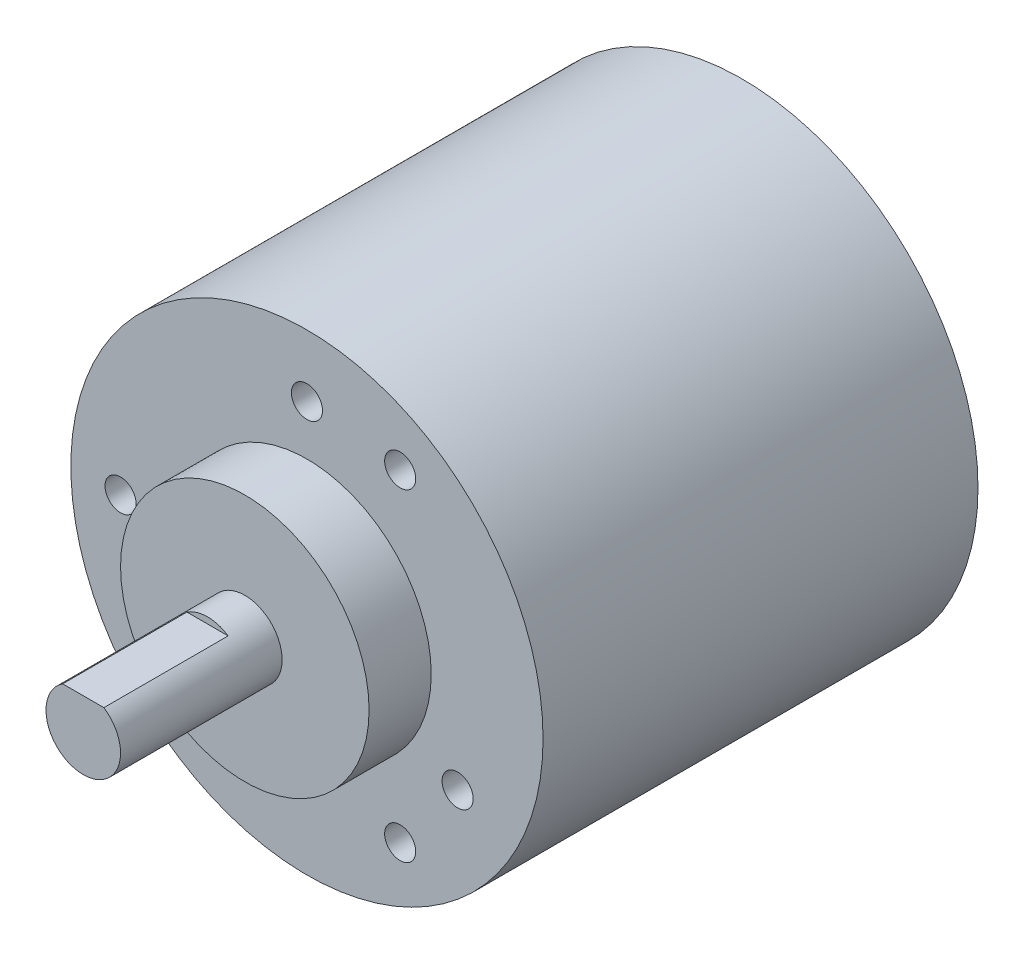
from build123d import *

# Parameters (mm, degrees)
SKETCH1_R                       = 19
BOSS_EXTRUDE1_DEPTH             = 35
SKETCH2_R                       = 10
BOSS_EXTRUDE2_DEPTH             = 5
SKETCH3_R                       = 3
BOSS_EXTRUDE3_DEPTH             = 13
CUT_EXTRUDE1_START              = -10
CUT_EXTRUDE1_DEPTH              = 10
TAP_DRILL_FOR_M3X0_5_TAP1_D     = 2.5
TAP_DRILL_FOR_M3X0_5_TAP1_DEPTH = 5
TAP_DRILL_FOR_M3X0_5_TAP1_TIP   = 0.751075774


with BuildPart() as part:
    # Sketch1 → Boss-Extrude1 (new body)
    with BuildSketch(Plane.XY):
        Circle(SKETCH1_R)
    extrude(amount=BOSS_EXTRUDE1_DEPTH)

    # Sketch2 → Boss-Extrude2 (add)
    with BuildSketch(Plane.XY.offset(35)):
        Circle(SKETCH2_R)
    extrude(amount=BOSS_EXTRUDE2_DEPTH)

    # Sketch3 → Boss-Extrude3 (add)
    with BuildSketch(Plane.XY.offset(40)):
        with Locations(Location((0, 0, 0), (0, 0, 180))):
            Circle(SKETCH3_R)
    extrude(amount=BOSS_EXTRUDE3_DEPTH)

    # Sketch4 → Cut-Extrude1 (cut)
    with BuildSketch(Plane.XY.offset(53).offset(CUT_EXTRUDE1_START)):
        with BuildLine():
            Line((-1.658312395, 2.5), (1.658312395, 2.5))
            ThreePointArc((1.658312395, 2.5), (0, 3), (-1.658312395, 2.5))
        make_face()
    extrude(amount=CUT_EXTRUDE1_DEPTH, mode=Mode.SUBTRACT)

    # Tap Drill for M3x0.5 Tap1
    with Locations(Plane.XY.offset(35)):
        with Locations((-15, 0), (0, 14), (7.5, 12.990381057), (12.124355653, -7), (7.5, -12.990381057), (-12.124355653, -7)):
            Hole(TAP_DRILL_FOR_M3X0_5_TAP1_D / 2, depth=TAP_DRILL_FOR_M3X0_5_TAP1_DEPTH)
            with Locations((0, 0, -(TAP_DRILL_FOR_M3X0_5_TAP1_DEPTH + TAP_DRILL_FOR_M3X0_5_TAP1_TIP / 2))):  # 118° drill point
                Cone(0, TAP_DRILL_FOR_M3X0_5_TAP1_D / 2, TAP_DRILL_FOR_M3X0_5_TAP1_TIP, mode=Mode.SUBTRACT)


solid = part.part
